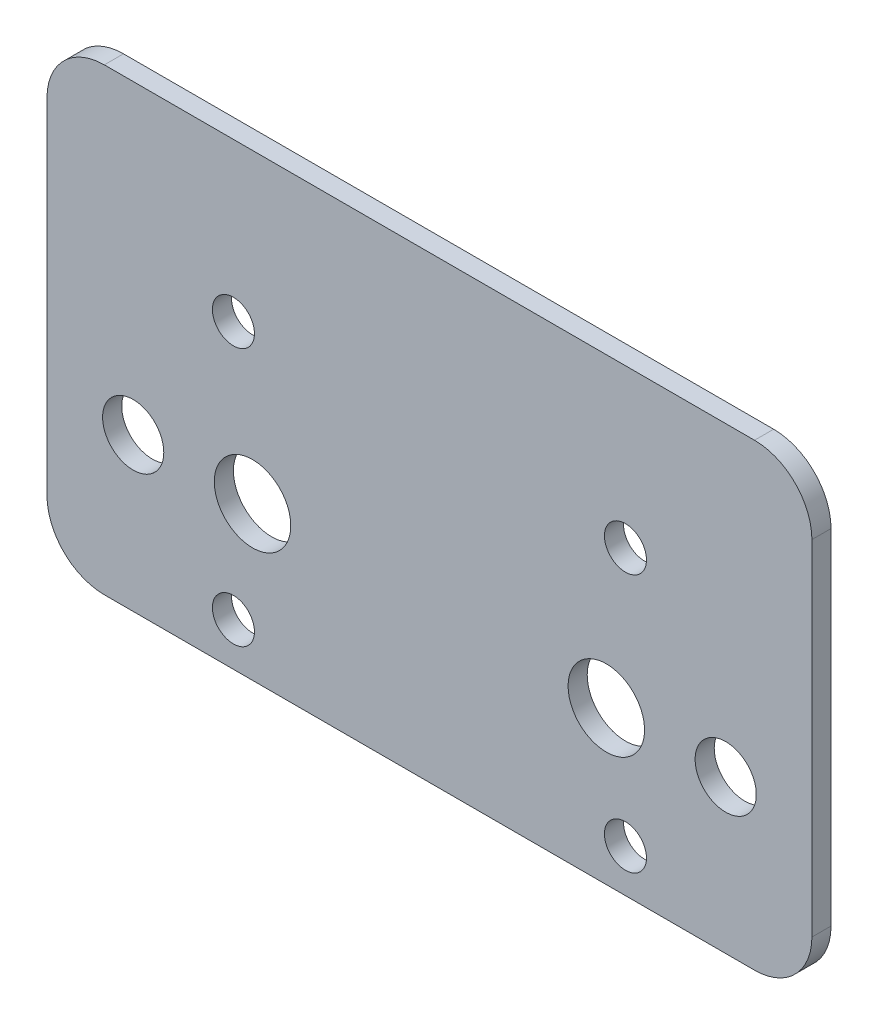
from build123d import *

# Parameters (mm, degrees)
SKETCH1_W           = 40
SKETCH1_H           = 24
SKETCH1_R           = 1.6
BOSS_EXTRUDE1_DEPTH = 1
FILLET1_R           = 3
CUT_EXTRUDE1_DEPTH  = 24.34523506


with BuildPart() as part:
    # Sketch1 → Boss-Extrude1 (new body)
    with BuildSketch(Plane.XY):
        Rectangle(SKETCH1_W, SKETCH1_H)
        with Locations((-15.491933385, -4)):
            Circle(SKETCH1_R, mode=Mode.SUBTRACT)
        with Locations(Location((15.491933385, -4, 0), (0, 0, 180))):
            Circle(SKETCH1_R, mode=Mode.SUBTRACT)
    extrude(amount=BOSS_EXTRUDE1_DEPTH)

    # Fillet1
    fillet1_edges = [part.edges().sort_by_distance(p)[0] for p in [
        (-20, 12, 0.5),
        (20, 12, 0.5),
        (20, -12, 0.5),
        (-20, -12, 0.5),
    ]]
    fillet(fillet1_edges, radius=FILLET1_R)

    # Sketch2 → Cut-Extrude1 (cut, through all)
    with BuildSketch(Plane(origin=(0, 0, 0), x_dir=(-1, 0, 0), z_dir=(0, 0, -1))):
        with BuildLine():
            ThreePointArc((10.25, 4.85), (9.15, 3.75), (10.25, 2.65))
            ThreePointArc((10.25, 2.65), (11.35, 3.75), (10.25, 4.85))
        make_face()
        with BuildLine():
            ThreePointArc((10.25, -8.65), (9.15, -9.75), (10.25, -10.85))
            ThreePointArc((10.25, -10.85), (11.35, -9.75), (10.25, -8.65))
        make_face()
        with BuildLine():
            ThreePointArc((-10.25, 4.85), (-11.35, 3.75), (-10.25, 2.65))
            ThreePointArc((-10.25, 2.65), (-9.15, 3.75), (-10.25, 4.85))
        make_face()
        with BuildLine():
            ThreePointArc((-10.25, -8.65), (-11.35, -9.75), (-10.25, -10.85))
            ThreePointArc((-10.25, -10.85), (-9.15, -9.75), (-10.25, -8.65))
        make_face()
        with BuildLine():
            ThreePointArc((-9.25, -6), (-7.25, -4), (-9.25, -2))
            ThreePointArc((-9.25, -2), (-11.25, -4), (-9.25, -6))
        make_face()
        with BuildLine():
            ThreePointArc((9.25, -2), (7.25, -4), (9.25, -6))
            ThreePointArc((9.25, -6), (11.25, -4), (9.25, -2))
        make_face()
    extrude(amount=-CUT_EXTRUDE1_DEPTH, mode=Mode.SUBTRACT)


solid = part.part
